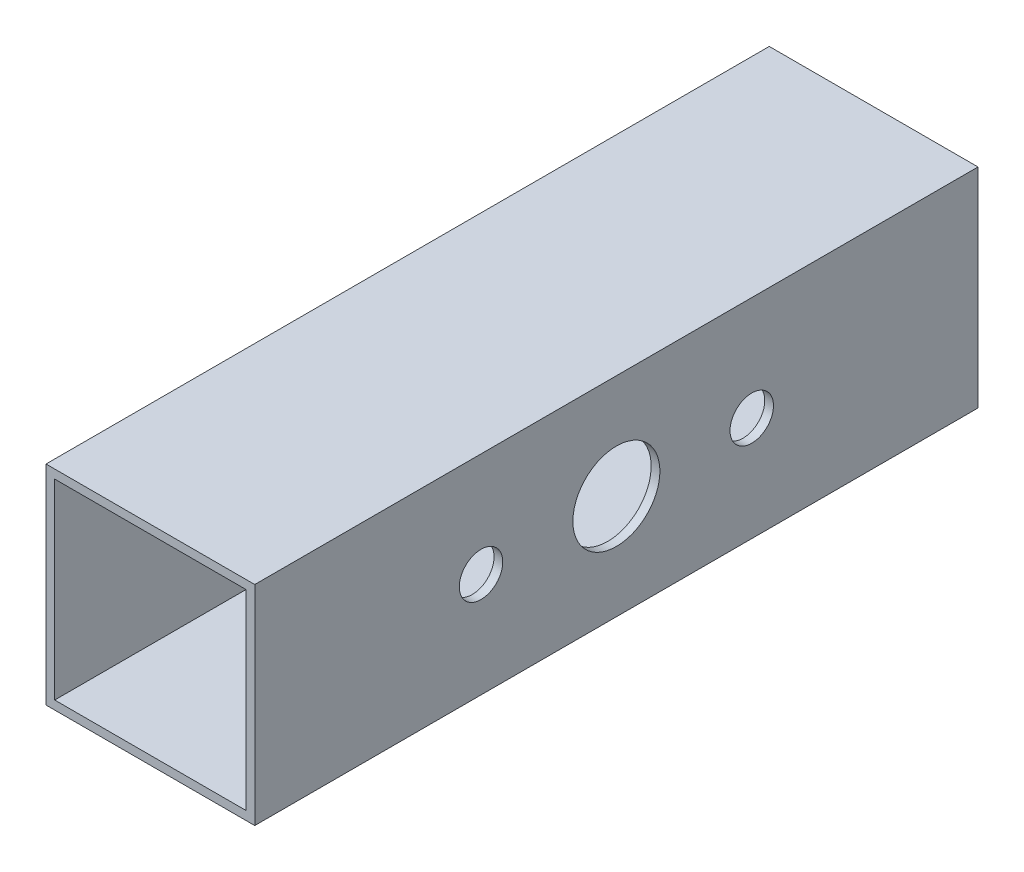
from build123d import *

# Parameters (mm, degrees)
SKETCH1_W           = 76.2
SKETCH1_H           = 76.2
SKETCH1_W_2         = 69.85
SKETCH1_H_2         = 69.85
BOSS_EXTRUDE1_DEPTH = 132
SKETCH2_R           = 15.875
SKETCH2_R_2         = 7.9375
CUT_EXTRUDE1_DEPTH  = 158.105219519


with BuildPart() as part:
    # Sketch1 → Boss-Extrude1 (new, symmetric)
    with BuildSketch(Plane.XY):
        Rectangle(SKETCH1_W, SKETCH1_H)
        Rectangle(SKETCH1_W_2, SKETCH1_H_2, mode=Mode.SUBTRACT)
    extrude(amount=BOSS_EXTRUDE1_DEPTH, both=True)

    # Sketch2 → Cut-Extrude1 (cut, through all)
    with BuildSketch(Plane.ZY.offset(38.1)):
        Circle(SKETCH2_R)
        with Locations((-49.4109375, 0)):
            Circle(SKETCH2_R_2)
        with Locations((49.4109375, 0)):
            Circle(SKETCH2_R_2)
    extrude(amount=-CUT_EXTRUDE1_DEPTH, mode=Mode.SUBTRACT)


solid = part.part
